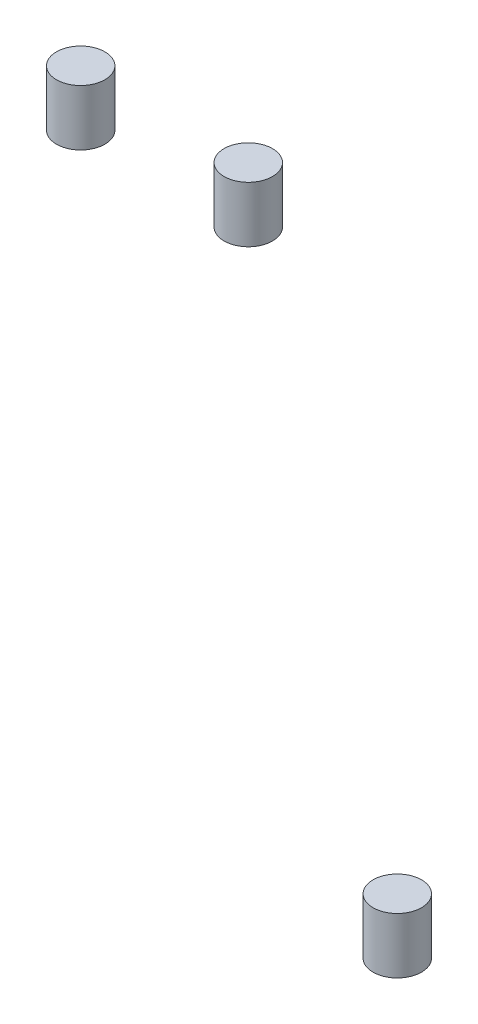
from build123d import *

# Parameters (mm, degrees)
BOSS_EXTRUDE1_START = 1750
SKETCH1_R           = 130
BOSS_EXTRUDE1_DEPTH = 300
BOSS_EXTRUDE2_START = 1750
SKETCH2_R           = 130
BOSS_EXTRUDE2_DEPTH = 300
BOSS_EXTRUDE3_START = -2050
SKETCH3_R           = 130
BOSS_EXTRUDE3_DEPTH = 300


with BuildPart() as part:
    # Sketch1 → Boss-Extrude1 (new body)
    with BuildSketch(Plane(origin=(0, 0, 0), x_dir=(1, 0, 0), z_dir=(0, 1, 0)).offset(BOSS_EXTRUDE1_START)):
        with Locations(Location((450, -400, 0), (0, 0, 270))):
            Circle(SKETCH1_R)
    extrude(amount=BOSS_EXTRUDE1_DEPTH)


with BuildPart() as body_2:
    # Sketch2 → Boss-Extrude2 (new body)
    with BuildSketch(Plane(origin=(0, 0, 0), x_dir=(1, 0, 0), z_dir=(0, 1, 0)).offset(BOSS_EXTRUDE2_START)):
        with Locations(Location((-450, -400, 0), (0, 0, 270))):
            Circle(SKETCH2_R)
    extrude(amount=BOSS_EXTRUDE2_DEPTH)


with BuildPart() as body_3:
    # Sketch3 → Boss-Extrude3 (new body)
    with BuildSketch(Plane(origin=(0, 0, 0), x_dir=(1, 0, 0), z_dir=(0, 1, 0)).offset(BOSS_EXTRUDE3_START)):
        with Locations(Location((450, 400, 0), (0, 0, 270))):
            Circle(SKETCH3_R)
    extrude(amount=BOSS_EXTRUDE3_DEPTH)


solid = Compound([part.part, body_2.part, body_3.part])
